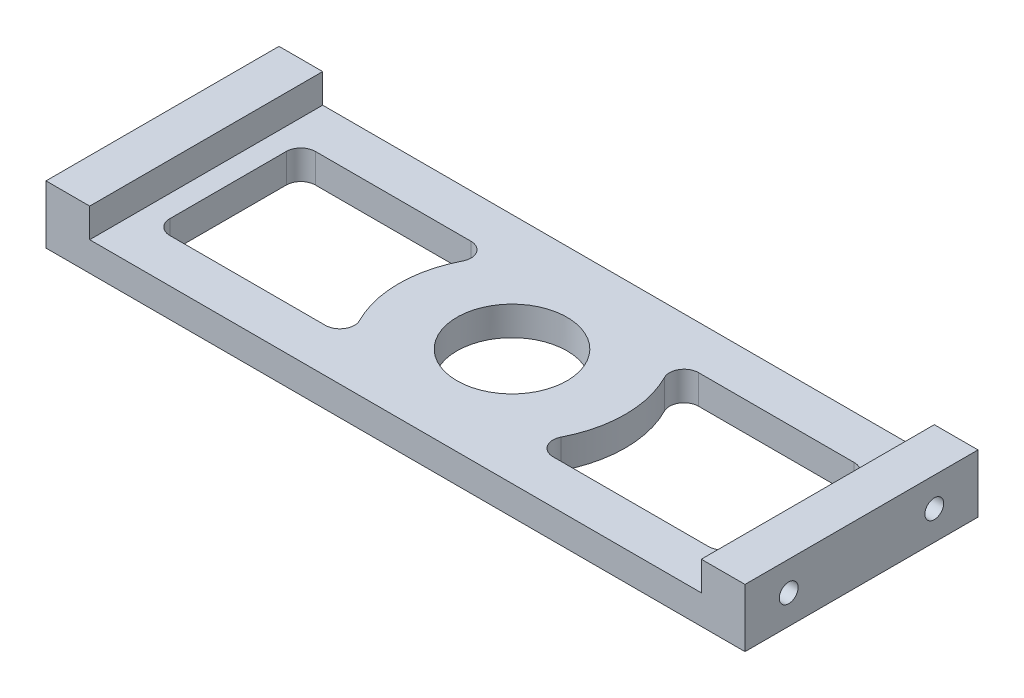
from build123d import *

# Parameters (mm, degrees)
SKETCH1_W                    = 76.2
SKETCH1_H                    = 25.4
BOSS_EXTRUDE1_DEPTH          = 1.5875
F_12_0MM_DOWEL_HOLE1_D       = 12
SKETCH5_W                    = 4.7625
SKETCH5_H                    = 25.4
BOSS_EXTRUDE2_DEPTH          = 3.175
M2_5X0_45_TAPPED_HOLE1_D     = 2.05
M2_5X0_45_TAPPED_HOLE1_DEPTH = 3.999992
M2_5X0_45_TAPPED_HOLE1_TIP   = 0.615882135
M2_5X0_45_TAPPED_HOLE2_D     = 2.05
M2_5X0_45_TAPPED_HOLE2_DEPTH = 3.999992
M2_5X0_45_TAPPED_HOLE2_TIP   = 0.615882135
CUT_EXTRUDE1_DEPTH           = 41.286233691
FILLET1_R                    = 1.5875


with BuildPart() as part:
    # Sketch1 → Boss-Extrude1 (new, symmetric)
    with BuildSketch(Plane(origin=(0, 0, 0), x_dir=(1, 0, 0), z_dir=(0, 1, 0))):
        Rectangle(SKETCH1_W, SKETCH1_H)
    extrude(amount=BOSS_EXTRUDE1_DEPTH, both=True)

    # Ø12.0mm Dowel Hole1 (through all)
    with Locations(Plane(origin=(0, 1.5875, 0), x_dir=(1, 0, 0), z_dir=(0, 1, 0))):
        with Locations((0, 0)):
            Hole(F_12_0MM_DOWEL_HOLE1_D / 2)

    # Sketch5 → Boss-Extrude2 (add)
    with BuildSketch(Plane(origin=(0, 1.5875, 0), x_dir=(1, 0, 0), z_dir=(0, 1, 0))):
        with Locations((-35.71875, 0)):
            Rectangle(SKETCH5_W, SKETCH5_H)
    boss_extrude2 = extrude(amount=BOSS_EXTRUDE2_DEPTH)

    # Mirror1: Boss-Extrude2 across plane
    add(boss_extrude2.mirror(Plane(origin=(0, 0, 0), x_dir=(0, 0, 1), z_dir=(1, 0, 0))))

    # M2.5x0.45 Tapped Hole1
    with Locations(Plane.ZY.offset(38.1)):
        with Locations((7.9375, 1.5875), (-7.9375, 1.5875)):
            Hole(M2_5X0_45_TAPPED_HOLE1_D / 2, depth=M2_5X0_45_TAPPED_HOLE1_DEPTH)
            with Locations((0, 0, -(M2_5X0_45_TAPPED_HOLE1_DEPTH + M2_5X0_45_TAPPED_HOLE1_TIP / 2))):  # 118° drill point
                Cone(0, M2_5X0_45_TAPPED_HOLE1_D / 2, M2_5X0_45_TAPPED_HOLE1_TIP, mode=Mode.SUBTRACT)

    # M2.5x0.45 Tapped Hole2
    with Locations(Plane(origin=(38.1, 0, 0), x_dir=(0, 0, -1), z_dir=(1, 0, 0))):
        with Locations((-7.9375, 1.5875), (7.9375, 1.5875)):
            Hole(M2_5X0_45_TAPPED_HOLE2_D / 2, depth=M2_5X0_45_TAPPED_HOLE2_DEPTH)
            with Locations((0, 0, -(M2_5X0_45_TAPPED_HOLE2_DEPTH + M2_5X0_45_TAPPED_HOLE2_TIP / 2))):  # 118° drill point
                Cone(0, M2_5X0_45_TAPPED_HOLE2_D / 2, M2_5X0_45_TAPPED_HOLE2_TIP, mode=Mode.SUBTRACT)

    # Sketch12 → Cut-Extrude1 (cut, through all)
    with BuildSketch(Plane(origin=(0, 1.5875, 0), x_dir=(1, 0, 0), z_dir=(0, 1, 0))):
        with BuildLine():
            Line((-30.95625, 7.9375), (-30.95625, -7.9375))
            Line((-30.95625, -7.9375), (-9.461426623, -7.9375))
            ThreePointArc((-9.461426623, -7.9375), (-12.35, 0), (-9.461426623, 7.9375))
            Line((-9.461426623, 7.9375), (-30.95625, 7.9375))
        make_face()
    cut_extrude1 = extrude(amount=-CUT_EXTRUDE1_DEPTH, mode=Mode.SUBTRACT)

    # Mirror2: Cut-Extrude1 across plane
    add(cut_extrude1.mirror(Plane(origin=(0, 0, 0), x_dir=(0, 0, 1), z_dir=(1, 0, 0))), mode=Mode.SUBTRACT)

    # Fillet1
    fillet1_edges = [part.edges().sort_by_distance(p)[0] for p in [
        (-30.95625, 0, -7.9375),
        (-9.461426623, 0, -7.9375),
        (-9.461426623, 0, 7.9375),
        (-30.95625, 0, 7.9375),
        (9.461426623, 0, -7.9375),
        (30.95625, 0, -7.9375),
        (30.95625, 0, 7.9375),
        (9.461426623, 0, 7.9375),
    ]]
    fillet(fillet1_edges, radius=FILLET1_R)


solid = part.part
